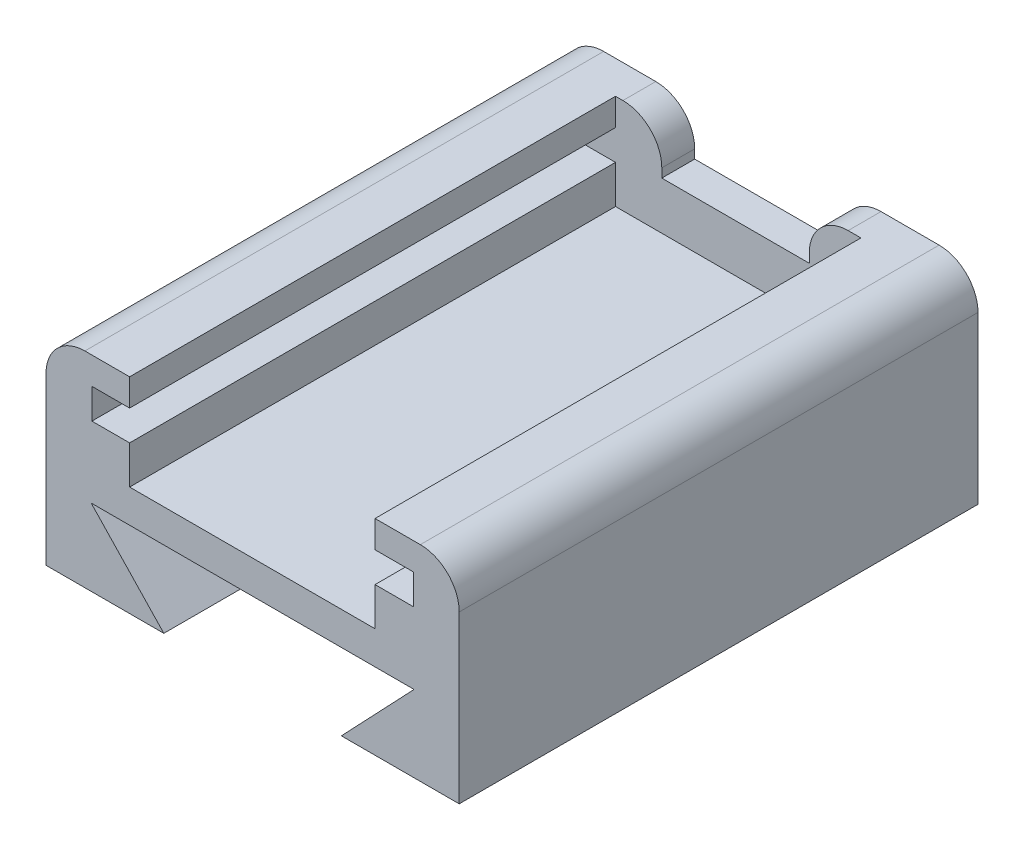
from build123d import *

# Parameters (mm, degrees)
SKETCH1_W           = 26.999946
SKETCH1_H           = 13.40000114
BOSS_EXTRUDE2_DEPTH = 33.90000078
FILLET2_R           = 2.54
FILLET6_R           = 2.54
CUT_EXTRUDE3_DEPTH  = 31.75
CUT_EXTRUDE4_DEPTH  = 21.10000098
SKETCH13_W          = 9.637018572
SKETCH13_H          = 3.12024758
CUT_EXTRUDE5_DEPTH  = 21.10000098
FILLET7_R           = 2.54
FILLET8_R           = 2.54
CUT_EXTRUDE6_DEPTH  = 0.5


with BuildPart() as part:
    # Sketch1 → Boss-Extrude2 (new body)
    with BuildSketch(Plane.XY):
        with Locations((-48.130528347, -24.945290526)):
            Rectangle(SKETCH1_W, SKETCH1_H)
    extrude(amount=BOSS_EXTRUDE2_DEPTH)

    # Fillet2
    fillet2_edges = [part.edges().sort_by_distance(p)[0] for p in [
        (-61.630501347, -18.245289956, 16.95000039),
    ]]
    fillet(fillet2_edges, radius=FILLET2_R)

    # Fillet6
    fillet6_edges = [part.edges().sort_by_distance(p)[0] for p in [
        (-34.630555347, -18.245289956, 16.95000039),
    ]]
    fillet(fillet6_edges, radius=FILLET6_R)

    # Sketch5 → Cut-Extrude3 (cut)
    with BuildSketch(Plane.XY.offset(33.90000078)):
        Polygon((-40.130518947, -18.245289956), (-56.166507941, -18.245289956), (-56.166507941, -20.01667393), (-58.630527667, -20.01667393), (-58.630527667, -21.985785037), (-56.166507941, -21.985785037), (-56.166507941, -24.485785117), (-40.130518947, -24.485785117), (-40.130518947, -21.985785037), (-37.630529027, -21.985785037), (-37.630529027, -20.01667393), (-40.130518947, -20.01667393), align=None)
    extrude(amount=-CUT_EXTRUDE3_DEPTH, mode=Mode.SUBTRACT)

    # Sketch5<10> → Cut-Extrude4 (cut)
    with BuildSketch(Plane.XY.offset(33.90000078)):
        Polygon((-37.580528365, -26.645301096), (-58.680528329, -26.645301096), (-53.930516747, -31.645291096), (-42.330539947, -31.645291096), align=None)
    extrude(amount=-CUT_EXTRUDE4_DEPTH, mode=Mode.SUBTRACT)

    # Sketch13 → Cut-Extrude5 (cut)
    with BuildSketch(Plane.XY.offset(2.15000078)):
        with Locations((-48.324844449, -19.805413746)):
            Rectangle(SKETCH13_W, SKETCH13_H)
    extrude(amount=-CUT_EXTRUDE5_DEPTH, mode=Mode.SUBTRACT)

    # Fillet7
    fillet7_edges = [part.edges().sort_by_distance(p)[0] for p in [
        (-53.143353735, -18.245289956, 1.07500039),
    ]]
    fillet(fillet7_edges, radius=FILLET7_R)

    # Fillet8
    fillet8_edges = [part.edges().sort_by_distance(p)[0] for p in [
        (-43.506335163, -18.245289956, 1.07500039),
    ]]
    fillet(fillet8_edges, radius=FILLET8_R)

    # Sketch14 → Cut-Extrude6 (cut)
    # profile 1 of 4: a face of its own
    with BuildSketch(Plane.ZY.offset(61.630501347)):
        Polygon((10.379133327, -25.575254401), (11.348470448, -25.575254401), (11.860799994, -27.845860462), (12.370724236, -25.575254401), (13.34246666, -25.575254401), (12.306983706, -29.038890765), (11.377334084, -29.038890765), align=None)
    # profile 2 of 4: a face of its own
    with BuildSketch(Plane.ZY.offset(61.630501347)):
        Polygon((15.940193933, -29.038890765), (14.939587872, -29.038890765), (14.939587872, -24.882527129), (14.323830297, -24.882527129), (14.323830297, -23.958890765), (15.940193933, -23.958890765), align=None)
    # profile 3 of 4: a face of its own
    with BuildSketch(Plane.ZY.offset(61.630501347)):
        with BuildLine():
            add(Edge.make_bspline(
                [(18.097750751, -27.88434531), (18.138079406, -27.886280917), (18.217803819, -27.890107354), (18.332685422, -27.925110839), (18.438493733, -27.983109537), (18.53145822, -28.062297179), (18.611571397, -28.154662261), (18.668745196, -28.260613669), (18.705969735, -28.375771267), (18.709369212, -28.456515949), (18.711103024, -28.497697583)],
                knots=[0, 0, 0, 0, 1.003562546, 1.983910333, 2.963493518, 3.99241943, 5.013694866, 5.993278051, 6.976525906, 8, 8, 8, 8], degree=3))
            add(Edge.make_bspline(
                [(18.711103024, -28.497697583), (18.709332109, -28.538870465), (18.705843349, -28.619982384), (18.66877096, -28.735949334), (18.61158104, -28.843047203), (18.531851067, -28.936625461), (18.438485669, -29.015968524), (18.332472116, -29.073558386), (18.218032192, -29.110465638), (18.138116937, -29.114049971), (18.097750751, -29.115860462)],
                knots=[0, 0, 0, 0, 1.019791572, 2.009022661, 2.993832134, 4.019055907, 5.04427968, 6.020338265, 7.000048334, 8, 8, 8, 8], degree=3))
            add(Edge.make_bspline(
                [(18.097750751, -29.115860462), (18.056577634, -29.114089682), (17.975465252, -29.110601189), (17.859501693, -29.073526848), (17.7523909, -29.016344367), (17.658862826, -28.936585509), (17.579103967, -28.843057434), (17.521921486, -28.735946641), (17.484847145, -28.619983083), (17.481358652, -28.5388707), (17.479587872, -28.497697583)],
                knots=[0, 0, 0, 0, 1.014956344, 1.999497103, 2.979637211, 4, 5.020362789, 6.000502897, 6.985043656, 8, 8, 8, 8], degree=3))
            add(Edge.make_bspline(
                [(17.479587872, -28.497697583), (17.481321547, -28.456515711), (17.484720757, -28.375770564), (17.52194724, -28.260616349), (17.579113639, -28.15465206), (17.659255671, -28.062337208), (17.752381665, -27.98273207), (17.859290503, -27.925141489), (17.975692779, -27.889977159), (18.056615376, -27.886243328), (18.097750751, -27.88434531)],
                knots=[0, 0, 0, 0, 1.018600418, 1.99716615, 2.972084663, 3.988496894, 5.012523168, 5.996182348, 6.981399582, 8, 8, 8, 8], degree=3))
        make_face()
    # profile 4 of 4: a face of its own
    with BuildSketch(Plane.ZY.offset(61.630501347)):
        with BuildLine():
            add(Edge.make_bspline(
                [(20.931197721, -23.881921068), (20.985056731, -23.883226878), (21.090720928, -23.885788702), (21.244769307, -23.9152334), (21.391323862, -23.959060405), (21.53023961, -24.022398267), (21.660121307, -24.105005226), (21.782851726, -24.204293049), (21.895973442, -24.322648707), (22.003567328, -24.45799688), (22.099228141, -24.617851329), (22.181436149, -24.803459821), (22.252687382, -25.015027832), (22.307614559, -25.254546124), (22.351696434, -25.520863888), (22.383569998, -25.814341296), (22.402798135, -26.134628461), (22.404674049, -26.356949463), (22.405648478, -26.472432432)],
                knots=[0, 0, 0, 0, 0.771332613, 1.513251727, 2.240597296, 2.960866685, 3.694499943, 4.442341285, 5.21879767, 6.037573001, 6.916942947, 7.881745747, 8.943344806, 10.113149818, 11.401222121, 12.812386846, 14.344218373, 16, 16, 16, 16], degree=3))
            add(Edge.make_bspline(
                [(22.405648478, -26.472432432), (22.404396907, -26.580284923), (22.401971255, -26.789312273), (22.386138652, -27.092435851), (22.355273116, -27.373547315), (22.317074669, -27.634146245), (22.264120154, -27.872655129), (22.201185652, -28.090561812), (22.12533943, -28.286671889), (22.038100385, -28.462107021), (21.937763793, -28.616445143), (21.825408362, -28.750170898), (21.700591375, -28.863457877), (21.56272832, -28.955830715), (21.412541396, -29.02928702), (21.248699637, -29.078338647), (21.073649557, -29.111564085), (20.95260947, -29.114400499), (20.890307569, -29.115860462)],
                knots=[0, 0, 0, 0, 1.50870248, 2.923994413, 4.243638183, 5.463389085, 6.60625131, 7.658463092, 8.633168196, 9.543499728, 10.394265693, 11.20201185, 11.98019515, 12.743837022, 13.516301738, 14.309116721, 15.129666499, 16, 16, 16, 16], degree=3))
            add(Edge.make_bspline(
                [(20.890307569, -29.115860462), (20.836888052, -29.113860582), (20.731792627, -29.109926098), (20.577605949, -29.08328872), (20.431278661, -29.037401328), (20.292554261, -28.972494441), (20.161048263, -28.890514566), (20.037037811, -28.789829672), (19.923549635, -28.668805966), (19.813059733, -28.532748539), (19.714981126, -28.371841479), (19.631556022, -28.185280667), (19.561076018, -27.972767479), (19.502614059, -27.735154885), (19.459074354, -27.470874255), (19.427488834, -27.181406496), (19.406231962, -26.86561241), (19.404651566, -26.646453379), (19.403830297, -26.532565007)],
                knots=[0, 0, 0, 0, 0.767064978, 1.509093008, 2.239234133, 2.962992384, 3.702604544, 4.459666546, 5.24957235, 6.081234809, 6.972826761, 7.946696209, 9.00988814, 10.184161048, 11.457135305, 12.853252474, 14.364758447, 16, 16, 16, 16], degree=3))
            add(Edge.make_bspline(
                [(19.403830297, -26.532565007), (19.405343313, -26.41147649), (19.408246136, -26.179160165), (19.4265832, -25.845544201), (19.460122793, -25.541240094), (19.505983736, -25.265890236), (19.565277062, -25.019515889), (19.638180282, -24.802581782), (19.724031949, -24.614256394), (19.824861367, -24.454207089), (19.9380296, -24.320016414), (20.055058691, -24.20194265), (20.181610946, -24.104387273), (20.313449939, -24.022069601), (20.453651131, -23.959560534), (20.601126046, -23.914985992), (20.755273234, -23.885984152), (20.860912228, -23.883286137), (20.9143606, -23.881921068)],
                knots=[0, 0, 0, 0, 1.696240751, 3.25435002, 4.678185503, 5.982669853, 7.1621562, 8.224110319, 9.183849441, 10.054717565, 10.864316389, 11.638635857, 12.3788924, 13.097379862, 13.811243946, 14.5217872, 15.252093721, 16, 16, 16, 16], degree=3))
            Line((20.9143606, -23.881921068), (20.931197721, -23.881921068))
        make_face()
        with BuildLine():
            add(Edge.make_bspline(
                [(20.902334084, -24.882527129), (20.875471577, -24.884870991), (20.820892064, -24.889633275), (20.742813172, -24.929610862), (20.672853012, -24.993841058), (20.61302329, -25.063342849), (20.574863691, -25.147278796), (20.549528727, -25.242115173), (20.52960129, -25.366715462), (20.511817776, -25.521619069), (20.497717132, -25.706149249), (20.488816901, -25.921545642), (20.482842083, -26.166925762), (20.481902018, -26.34093843), (20.481406054, -26.432744932)],
                knots=[0, 0, 0, 0, 0.555089739, 1.127836905, 1.776342633, 2.521778993, 3.009072645, 3.674991373, 4.552665314, 5.624338466, 6.908813976, 8.390474787, 10.095668052, 12, 12, 12, 12], degree=3))
            add(Edge.make_bspline(
                [(20.481406054, -26.432744932), (20.481945816, -26.534170548), (20.482965706, -26.725816263), (20.488362251, -26.996086799), (20.499121627, -27.232267848), (20.513254629, -27.434806561), (20.530099199, -27.603936191), (20.551916511, -27.739197856), (20.577922908, -27.841013489), (20.617450756, -27.929377897), (20.678503158, -28.001478729), (20.750060893, -28.066794249), (20.828707046, -28.108210985), (20.883868692, -28.112946479), (20.910752645, -28.115254401)],
                knots=[0, 0, 0, 0, 1.953528676, 3.691231172, 5.206184117, 6.506653282, 7.601487946, 8.478619439, 9.143630876, 9.62034953, 10.329399348, 10.942446392, 11.484583531, 12, 12, 12, 12], degree=3))
            add(Edge.make_bspline(
                [(20.910752645, -28.115254401), (20.93049651, -28.114439123), (20.969437533, -28.112831143), (21.024801567, -28.096989041), (21.074883049, -28.070519149), (21.120060306, -28.034248702), (21.158040543, -27.985579189), (21.193751652, -27.929498826), (21.220495823, -27.86133495), (21.244716879, -27.783813426), (21.265207075, -27.693334798), (21.280994345, -27.589547907), (21.295689702, -27.471659753), (21.30728519, -27.340070415), (21.316828242, -27.193711688), (21.324150821, -27.033737078), (21.327370131, -26.859299015), (21.327831892, -26.738620097), (21.328072721, -26.675680538)],
                knots=[0, 0, 0, 0, 0.582331179, 1.14853764, 1.683660151, 2.247880787, 2.84543266, 3.499589125, 4.205728503, 4.99995591, 5.899311367, 6.943075691, 8.10079055, 9.409103481, 10.845466559, 12.434274638, 14.140311608, 16, 16, 16, 16], degree=3))
            Line((21.328072721, -26.675680538), (21.328072721, -26.425529023))
            add(Edge.make_bspline(
                [(21.328072721, -26.425529023), (21.327964777, -26.346952757), (21.327759328, -26.197400118), (21.322924549, -25.984090607), (21.31500423, -25.793187971), (21.30274379, -25.624401554), (21.28904144, -25.477487909), (21.2715248, -25.352135589), (21.250379714, -25.248857772), (21.22658848, -25.165182117), (21.197236366, -25.097740853), (21.167163941, -25.040324075), (21.132336877, -24.992213258), (21.095737604, -24.951666647), (21.053429134, -24.921492247), (21.009472024, -24.89753721), (20.960631425, -24.885816856), (20.927636139, -24.88364067), (20.910752645, -24.882527129)],
                knots=[0, 0, 0, 0, 2.191769581, 4.171551293, 5.951267545, 7.520785486, 8.891616004, 10.066614677, 11.049135632, 11.831021187, 12.487359542, 13.097797181, 13.634666562, 14.140969097, 14.612885563, 15.077996148, 15.528216039, 16, 16, 16, 16], degree=3))
            Line((20.910752645, -24.882527129), (20.902334084, -24.882527129))
        make_face(mode=Mode.SUBTRACT)
    extrude(amount=-CUT_EXTRUDE6_DEPTH, mode=Mode.SUBTRACT)


solid = part.part
